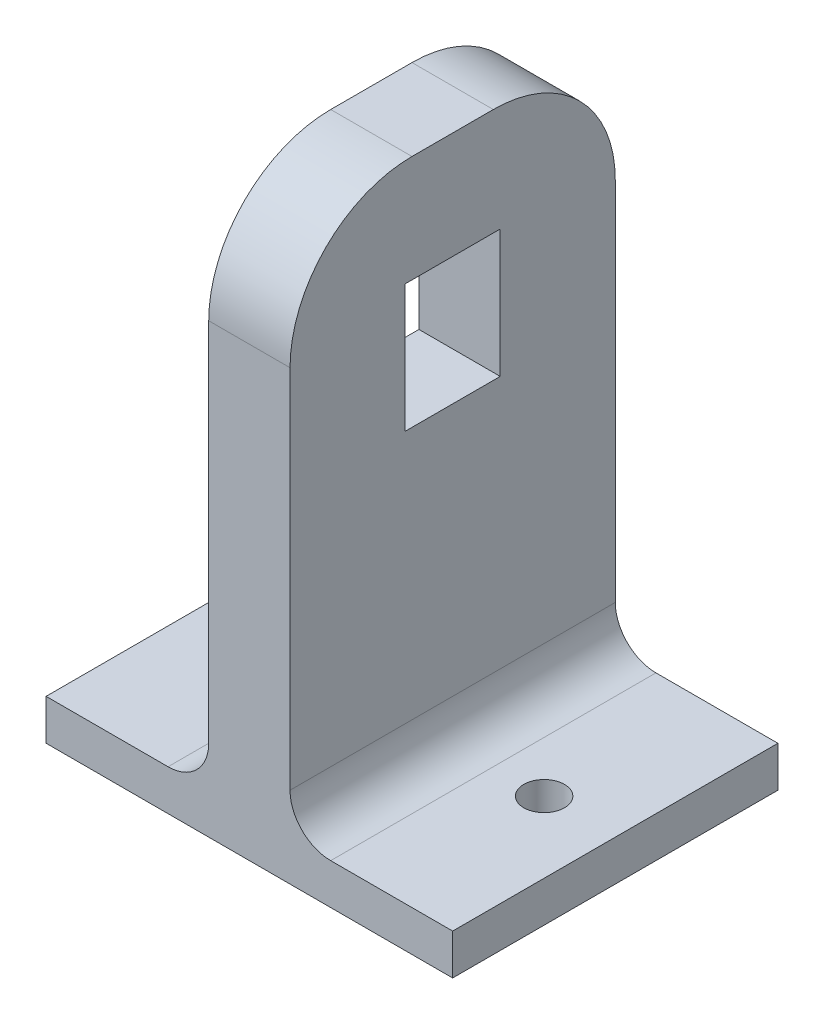
from build123d import *

# Parameters (mm, degrees)
SKETCH1_W           = 50.8
SKETCH1_H           = 88.9
SKETCH1_W_2         = 14.859
SKETCH1_H_2         = 19.939
BOSS_EXTRUDE1_DEPTH = 6.35
SKETCH2_W           = 50.8
SKETCH2_H           = 6.35
BOSS_EXTRUDE2_DEPTH = 31.75
FILLET1_R           = 6.35
SKETCH3_R           = 3.175
CUT_EXTRUDE1_DEPTH  = 93.020242338
FILLET2_R           = 19.05


with BuildPart() as part:
    # Sketch1 → Boss-Extrude1 (new, symmetric)
    with BuildSketch(Plane(origin=(0, 0, 0), x_dir=(0, 0, -1), z_dir=(1, 0, 0))):
        Rectangle(SKETCH1_W, SKETCH1_H)
        with Locations((0, 17.78)):
            Rectangle(SKETCH1_W_2, SKETCH1_H_2, mode=Mode.SUBTRACT)
    extrude(amount=BOSS_EXTRUDE1_DEPTH, both=True)

    # Sketch2 → Boss-Extrude2 (add, symmetric)
    with BuildSketch(Plane(origin=(0, 0, 0), x_dir=(0, 0, -1), z_dir=(1, 0, 0))):
        with Locations((0, -41.275)):
            Rectangle(SKETCH2_W, SKETCH2_H)
    extrude(amount=BOSS_EXTRUDE2_DEPTH, both=True)

    # Fillet1
    fillet1_edges = [part.edges().sort_by_distance(p)[0] for p in [
        (6.35, -38.1, 0),
        (-6.35, -38.1, 0),
    ]]
    fillet(fillet1_edges, radius=FILLET1_R)

    # Sketch3 → Cut-Extrude1 (cut, through all)
    with BuildSketch(Plane(origin=(0, -38.1, 0), x_dir=(1, 0, 0), z_dir=(0, 1, 0))):
        with Locations(Location((20.6375, 0, 0), (0, 0, 270))):
            Circle(SKETCH3_R)
    cut_extrude1 = extrude(amount=-CUT_EXTRUDE1_DEPTH, mode=Mode.SUBTRACT)

    # Mirror1: Cut-Extrude1 across plane
    add(cut_extrude1.mirror(Plane(origin=(0, 0, 0), x_dir=(0, 0, 1), z_dir=(1, 0, 0))), mode=Mode.SUBTRACT)

    # Fillet2
    fillet2_edges = [part.edges().sort_by_distance(p)[0] for p in [
        (0, 44.45, 25.4),
        (0, 44.45, -25.4),
    ]]
    fillet(fillet2_edges, radius=FILLET2_R)


solid = part.part
